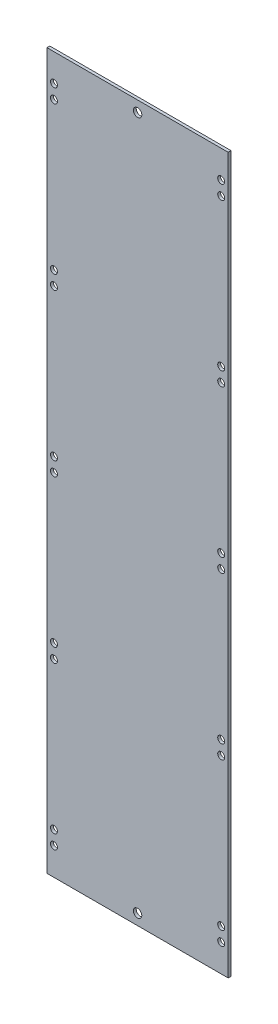
from build123d import *

# Parameters (mm, degrees)
SKETCH1_W           = 83
SKETCH1_H           = 327.5
BOSS_EXTRUDE1_DEPTH = 1.3
SKETCH2_R           = 1.6
CUT_EXTRUDE1_DEPTH  = 1.3
SKETCH3_R           = 1.93
CUT_EXTRUDE2_DEPTH  = 1.3


with BuildPart() as part:
    # Sketch1 → Boss-Extrude1 (new body)
    with BuildSketch(Plane.XY):
        with Locations((41.5, 163.75)):
            Rectangle(SKETCH1_W, SKETCH1_H)
    extrude(amount=BOSS_EXTRUDE1_DEPTH)

    # Sketch2 → Cut-Extrude1 (cut)
    with BuildSketch(Plane.XY.offset(1.3)):
        with Locations((3.2, 314.9)):
            Circle(SKETCH2_R)
        with Locations((3.2, 308.5)):
            Circle(SKETCH2_R)
        with Locations((79.8, 314.9)):
            Circle(SKETCH2_R)
        with Locations((79.8, 308.5)):
            Circle(SKETCH2_R)
        with Locations((3.2, 240.925)):
            Circle(SKETCH2_R)
        with Locations((3.2, 234.525)):
            Circle(SKETCH2_R)
        with Locations((79.8, 240.925)):
            Circle(SKETCH2_R)
        with Locations((79.8, 234.525)):
            Circle(SKETCH2_R)
        with Locations((3.2, 166.95)):
            Circle(SKETCH2_R)
        with Locations((3.2, 160.55)):
            Circle(SKETCH2_R)
        with Locations((79.8, 166.95)):
            Circle(SKETCH2_R)
        with Locations((79.8, 160.55)):
            Circle(SKETCH2_R)
        with Locations((3.2, 92.975)):
            Circle(SKETCH2_R)
        with Locations((3.2, 86.575)):
            Circle(SKETCH2_R)
        with Locations((79.8, 92.975)):
            Circle(SKETCH2_R)
        with Locations((79.8, 86.575)):
            Circle(SKETCH2_R)
        with Locations((3.2, 19)):
            Circle(SKETCH2_R)
        with Locations((3.2, 12.6)):
            Circle(SKETCH2_R)
        with Locations((79.8, 19)):
            Circle(SKETCH2_R)
        with Locations((79.8, 12.6)):
            Circle(SKETCH2_R)
    extrude(amount=-CUT_EXTRUDE1_DEPTH, mode=Mode.SUBTRACT)

    # Sketch3 → Cut-Extrude2 (cut)
    with BuildSketch(Plane.XY.offset(1.3)):
        with Locations((41.5, 322.524)):
            Circle(SKETCH3_R)
        with Locations((41.5, 4.976)):
            Circle(SKETCH3_R)
    extrude(amount=-CUT_EXTRUDE2_DEPTH, mode=Mode.SUBTRACT)


solid = part.part
